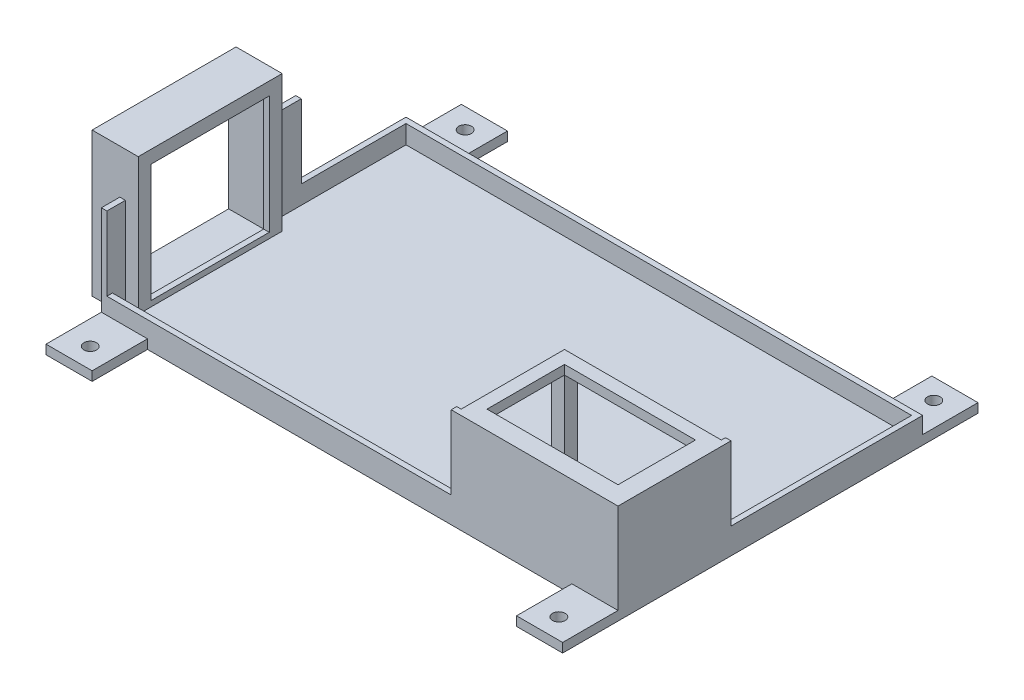
from build123d import *

# Parameters (mm, degrees)
SKETCH1_W             = 280
SKETCH1_H             = 165.1
FLOOR_2_DEPTH         = 4
SKETCH2_W             = 280
SKETCH2_H             = 165.1
SKETCH2_W_2           = 274
SKETCH2_H_2           = 159.1
WALL_DEPTH            = 10
RPI_START             = 45
SKETCH4_W             = 85
SKETCH4_H             = 56
SKETCH4_W_2           = 71
SKETCH4_H_2           = 42
RPI_STAND_DEPTH       = 5
SKETCH7_W             = 3
SKETCH7_H             = 105.333904831
TEMP_SUPPORT_DEPTH    = 40
SKETCH3_W             = 25
SKETCH3_H             = 30
SKETCH3_R             = 3.429
BRACKETS_DEPTH        = 5
FAN_HOLDER_DEPTH      = 15
FAN_HOLDER_DEPTH_BACK = 10
SKETCH5_W             = 78
SKETCH5_H             = 78
SKETCH5_W_2           = 70
SKETCH5_H_2           = 70
SKETCH8_W             = 70
SKETCH8_H             = 50
FAN_HOLE_DEPTH        = 3
SKETCH11_W            = 78
SKETCH11_H            = 78
SKETCH11_W_2          = 64
SKETCH11_H_2          = 64
BOSS_EXTRUDE9_DEPTH   = 3
BOSS_EXTRUDE10_REACH  = 199.721
SKETCH12_W            = 7
SKETCH12_H            = 7


with BuildPart() as part:
    # Sketch1 → Floor 2 (new body)
    with BuildSketch(Plane(origin=(0, 0, 0), x_dir=(1, 0, 0), z_dir=(0, 1, 0))):
        Rectangle(SKETCH1_W, SKETCH1_H)
    extrude(amount=FLOOR_2_DEPTH)

    # Sketch2 → Wall (add)
    with BuildSketch(Plane(origin=(0, 4, 0), x_dir=(1, 0, 0), z_dir=(0, 1, 0))):
        Rectangle(SKETCH2_W, SKETCH2_H)
        Rectangle(SKETCH2_W_2, SKETCH2_H_2, mode=Mode.SUBTRACT)
    extrude(amount=WALL_DEPTH)

    # Sketch7 → Temp support (add)
    with BuildSketch(Plane(origin=(0, 14, 0), x_dir=(1, 0, 0), z_dir=(0, 1, 0))):
        with Locations((-138.5, -29.883047585)):
            Rectangle(SKETCH7_W, SKETCH7_H)
        Polygon((140, -82.55), (49.61228981, -82.55), (49.61228981, -79.55), (137, -79.55), (137, -21.306937857), (140, -21.306937857), (140, -79.55), align=None)
    extrude(amount=TEMP_SUPPORT_DEPTH)

    # Sketch3 → Brackets (add)
    # profile 1 of 4: a face of its own
    with BuildSketch(Plane(origin=(0, 0, 0), x_dir=(1, 0, 0), z_dir=(0, 1, 0))):
        with Locations((-127.5, 97.55)):
            Rectangle(SKETCH3_W, SKETCH3_H)
        with Locations(Location((-127, 101.6, 0), (0, 0, 270))):
            Circle(SKETCH3_R, mode=Mode.SUBTRACT)
    # profile 2 of 4: a face of its own
    with BuildSketch(Plane(origin=(0, 0, 0), x_dir=(1, 0, 0), z_dir=(0, 1, 0))):
        with Locations((127.5, 97.55)):
            Rectangle(SKETCH3_W, SKETCH3_H)
        with Locations(Location((127, 101.6, 0), (0, 0, 270))):
            Circle(SKETCH3_R, mode=Mode.SUBTRACT)
    # profile 3 of 4: a face of its own
    with BuildSketch(Plane(origin=(0, 0, 0), x_dir=(1, 0, 0), z_dir=(0, 1, 0))):
        with Locations((-127.5, -97.55)):
            Rectangle(SKETCH3_W, SKETCH3_H)
        with Locations(Location((-127, -101.6, 0), (0, 0, 270))):
            Circle(SKETCH3_R, mode=Mode.SUBTRACT)
    # profile 4 of 4: a face of its own
    with BuildSketch(Plane(origin=(0, 0, 0), x_dir=(1, 0, 0), z_dir=(0, 1, 0))):
        with Locations((127.5, -97.55)):
            Rectangle(SKETCH3_W, SKETCH3_H)
        with Locations(Location((127, -101.6, 0), (0, 0, 270))):
            Circle(SKETCH3_R, mode=Mode.SUBTRACT)
    extrude(amount=BRACKETS_DEPTH)

    # Sketch5 → Fan Holder (add, two sides: drawn at the far end of the back side and taken through both)
    with BuildSketch(Plane.ZY.offset(140).offset(-FAN_HOLDER_DEPTH_BACK)):
        with Locations((33.55, 39)):
            Rectangle(SKETCH5_W, SKETCH5_H)
        with Locations((33.55, 39)):
            Rectangle(SKETCH5_W_2, SKETCH5_H_2, mode=Mode.SUBTRACT)
    extrude(amount=FAN_HOLDER_DEPTH + FAN_HOLDER_DEPTH_BACK)

    # Sketch8 → Fan hole (cut)
    with BuildSketch(Plane.ZY.offset(140)):
        with Locations((33.55, 29)):
            Rectangle(SKETCH8_W, SKETCH8_H)
    extrude(amount=-FAN_HOLE_DEPTH, mode=Mode.SUBTRACT)

    # Sketch11 → Boss-Extrude9 (add)
    with BuildSketch(Plane.ZY.offset(130)):
        with Locations((33.55, 39)):
            Rectangle(SKETCH11_W, SKETCH11_H)
        with Locations((33.55, 39)):
            Rectangle(SKETCH11_W_2, SKETCH11_H_2, mode=Mode.SUBTRACT)
    extrude(amount=BOSS_EXTRUDE9_DEPTH)

    # Sketch12 → Boss-Extrude10 (add, up to next)
    with BuildSketch(Plane.XZ.offset(-49), mode=Mode.PRIVATE) as boss_extrude10_sk1:
        with Locations((55.5, 27.05)):
            Rectangle(SKETCH12_W, SKETCH12_H)
    boss_extrude10_tool1 = extrude(boss_extrude10_sk1.sketch, amount=BOSS_EXTRUDE10_REACH, mode=Mode.PRIVATE) - part.part


with BuildPart() as body_2:
    # Sketch4 → Rpi stand (new body)
    with BuildSketch(Plane(origin=(0, 4, 0), x_dir=(1, 0, 0), z_dir=(0, 1, 0)).offset(RPI_START)):
        with Locations((94.5, -51.55)):
            Rectangle(SKETCH4_W, SKETCH4_H)
        with Locations((94.5, -51.55)):
            Rectangle(SKETCH4_W_2, SKETCH4_H_2, mode=Mode.SUBTRACT)
    extrude(amount=RPI_STAND_DEPTH)


with BuildPart() as part_1:
    add(part.part)

    add(body_2.part)  # Boss-Extrude10 merges body 2
    add(boss_extrude10_tool1.solids().sort_by_distance((55.5, 49, 27.05))[0])


solid = part_1.part
